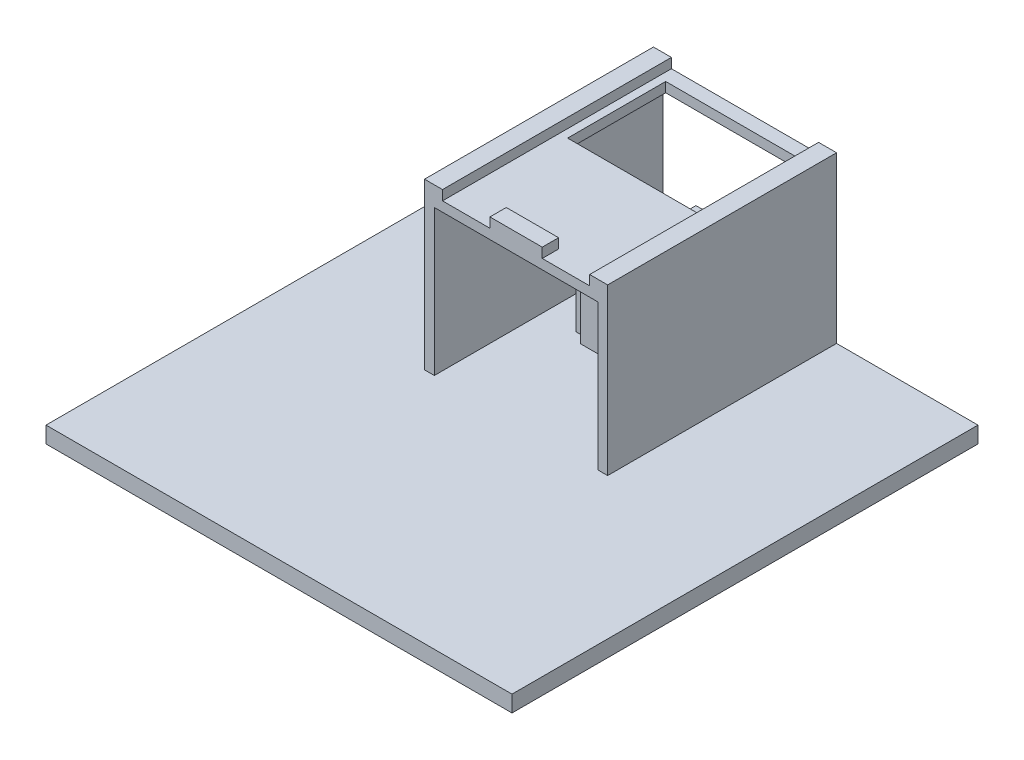
from build123d import *

# Parameters (mm, degrees)
BOSS_EXTRUDE2_DEPTH  = 28
SKETCH4_W            = 6.4
SKETCH4_H            = 26
CUT_EXTRUDE2_DEPTH   = 1.2
SKETCH5_W            = 16
SKETCH5_H            = 12
CUT_EXTRUDE3_DEPTH   = 1.2
SKETCH6_W            = 8.8
SKETCH6_H            = 17.8
BOSS_EXTRUDE3_DEPTH  = 2
SKETCH7_W            = 12
SKETCH7_H            = 6
BOSS_EXTRUDE4_DEPTH  = 15.7
SKETCH8_W            = 1.6
SKETCH8_H            = 6
CUT_EXTRUDE4_DEPTH   = 1
BOSS_EXTRUDE10_DEPTH = 57


with BuildPart() as part:
    # Sketch1 → Boss-Extrude2 (new body)
    with BuildSketch(Plane.XY):
        Polygon((9, -3.6), (9, -21.4), (10.2, -21.4), (10.2, -1.2), (8, -1.2), (8, -2.4), (2.2, -2.4), (2.2, -1.2), (-4.2, -1.2), (-4.2, -2.4), (-10, -2.4), (-10, -1.2), (-12.2, -1.2), (-12.2, -21.4), (-11, -21.4), (-11, -3.6), align=None)
    extrude(amount=BOSS_EXTRUDE2_DEPTH)

    # Sketch4 → Cut-Extrude2 (cut)
    with BuildSketch(Plane(origin=(0, -1.2, 0), x_dir=(1, 0, 0), z_dir=(0, 1, 0))):
        with Locations((-1, -13)):
            Rectangle(SKETCH4_W, SKETCH4_H)
    extrude(amount=-CUT_EXTRUDE2_DEPTH, mode=Mode.SUBTRACT)

    # Sketch5 → Cut-Extrude3 (cut)
    with BuildSketch(Plane(origin=(0, -2.4, 0), x_dir=(1, 0, 0), z_dir=(0, 1, 0))):
        with Locations((-1, -7.7)):
            Rectangle(SKETCH5_W, SKETCH5_H)
    extrude(amount=-CUT_EXTRUDE3_DEPTH, mode=Mode.SUBTRACT)

    # Sketch6 → Boss-Extrude3 (add)
    with BuildSketch(Plane(origin=(0, 0, 13.7), x_dir=(-1, 0, 0), z_dir=(0, 0, -1))):
        with Locations((1, -12.5)):
            Rectangle(SKETCH6_W, SKETCH6_H)
    extrude(amount=-BOSS_EXTRUDE3_DEPTH)

    # Sketch7 → Boss-Extrude4 (add)
    with BuildSketch(Plane.XY.offset(15.7)):
        with Locations((-1, -18.4)):
            Rectangle(SKETCH7_W, SKETCH7_H)
    extrude(amount=-BOSS_EXTRUDE4_DEPTH)

    # Sketch8 → Cut-Extrude4 (cut)
    with BuildSketch(Plane.XY.offset(15.7)):
        with Locations((-6.2, -18.4)):
            Rectangle(SKETCH8_W, SKETCH8_H)
        with Locations((4.2, -18.4)):
            Rectangle(SKETCH8_W, SKETCH8_H)
    extrude(amount=-CUT_EXTRUDE4_DEPTH, mode=Mode.SUBTRACT)

    # Sketch9 → Boss-Extrude10 (add)
    with BuildSketch(Plane(origin=(0, 0, 0), x_dir=(-1, 0, 0), z_dir=(0, 0, -1))):
        Polygon((1, -21.4), (29.5, -21.4), (29.5, -23.4), (-27.5, -23.4), (-27.5, -21.4), align=None)
    extrude(amount=-BOSS_EXTRUDE10_DEPTH)


solid = part.part
